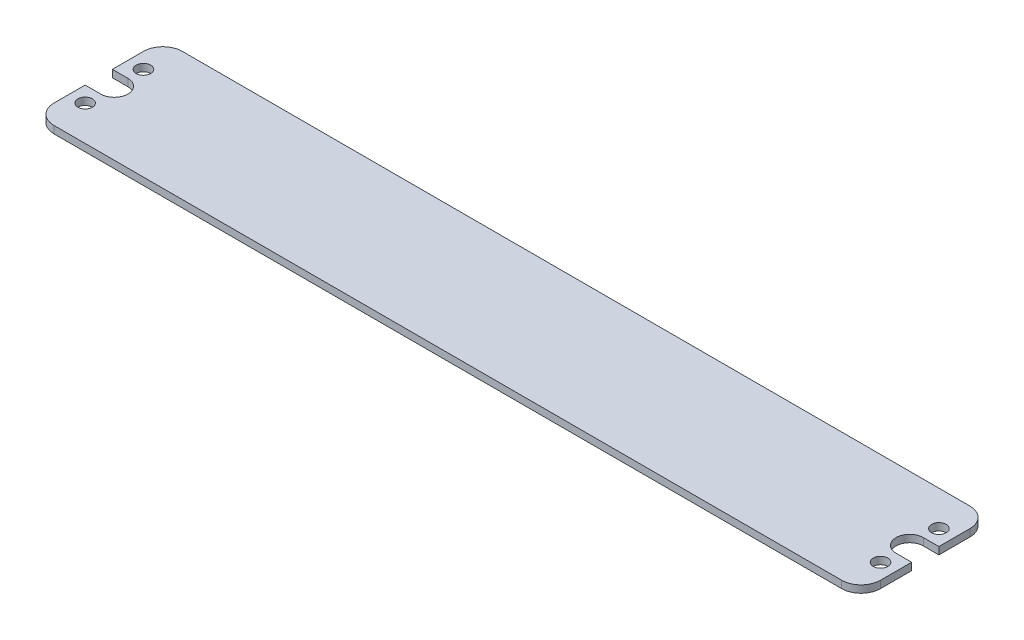
from build123d import *

# Parameters (mm, degrees)
SKETCH1_R           = 4.7625
BOSS_EXTRUDE1_DEPTH = 4.7625


with BuildPart() as part:
    # Sketch1 → Boss-Extrude1 (new body)
    with BuildSketch(Plane(origin=(0, 0, 0), x_dir=(1, 0, 0), z_dir=(0, 1, 0))):
        with BuildLine():
            Line((12.7, 0), (269.875, 0))
            Line((269.875, 0), (269.875, -83.82))
            Line((269.875, -83.82), (12.7, -83.82))
            ThreePointArc((12.7, -83.82), (3.719743879, -80.100256121), (0, -71.12))
            Line((0, -71.12), (0, -50.8))
            Line((0, -50.8), (10.16, -50.8))
            ThreePointArc((10.16, -50.8), (19.05, -41.91), (10.16, -33.02))
            Line((10.16, -33.02), (0, -33.02))
            Line((0, -33.02), (0, -12.7))
            ThreePointArc((0, -12.7), (3.719743879, -3.719743879), (12.7, 0))
        make_face()
        with Locations(Location((10.16, -60.96, 0), (0, 0, 90))):
            Circle(SKETCH1_R, mode=Mode.SUBTRACT)
        with Locations(Location((10.16, -22.86, 0), (0, 0, 90))):
            Circle(SKETCH1_R, mode=Mode.SUBTRACT)
    boss_extrude1 = extrude(amount=BOSS_EXTRUDE1_DEPTH)

    # Mirror1: Boss-Extrude1 across plane
    add(boss_extrude1.mirror(Plane(origin=(269.875, 4.7625, 0), x_dir=(0, 0, 1), z_dir=(-1, 0, 0))))


solid = part.part
